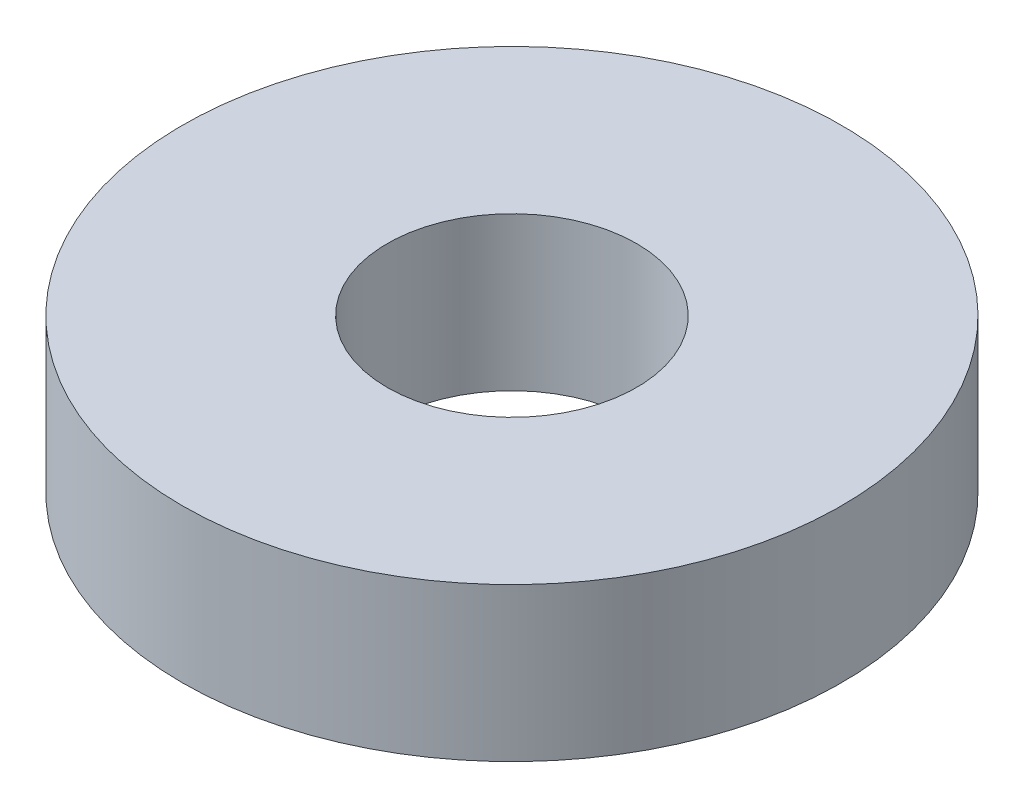
from build123d import *

# Parameters (mm, degrees)
SKETCH_1_R      = 32.24272922
SKETCH_1_R_2    = 12.2
EXTRUDE_1_DEPTH = 15


with BuildPart() as part:
    # 草图1 → 凸台-拉伸1 (new body)
    with BuildSketch(Plane(origin=(0, 0, 0), x_dir=(1, 0, 0), z_dir=(0, 1, 0))):
        with Locations(Location((0, 0, 0), (0, 0, 270))):
            Circle(SKETCH_1_R)
        with Locations(Location((0, 0, 0), (0, 0, 270))):
            Circle(SKETCH_1_R_2, mode=Mode.SUBTRACT)
    extrude(amount=EXTRUDE_1_DEPTH)


solid = part.part
